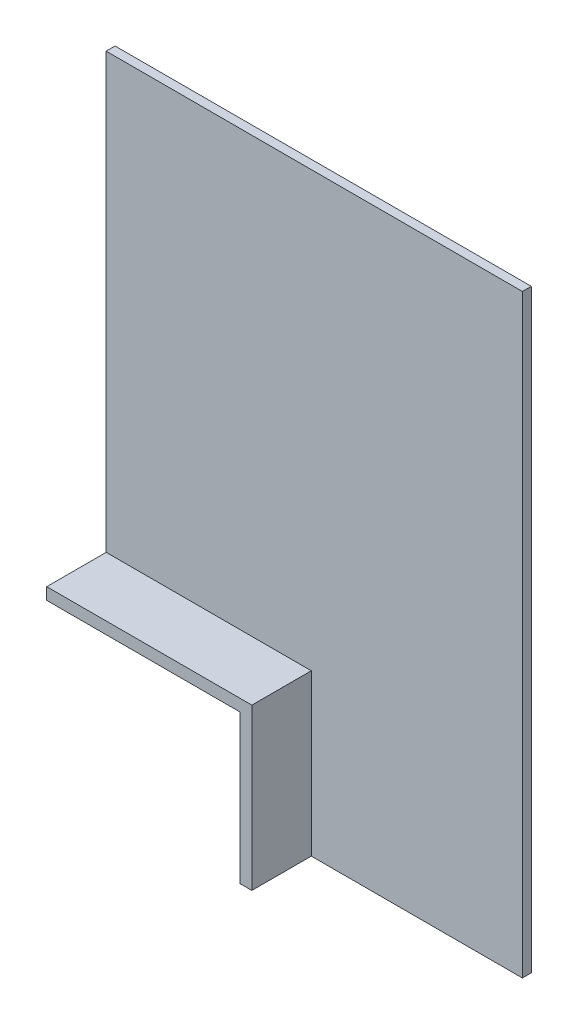
from build123d import *

# Parameters (mm, degrees)
SKETCH_1_W          = 140
SKETCH_1_H          = 200
EXTRUDE_1_DEPTH     = 3
SKETCH_2_W          = 65
SKETCH_2_H          = 50
CUT_EXTRUDE_1_DEPTH = 10
SKETCH_3_W          = 4
SKETCH_3_H          = 50
EXTRUDE_2_DEPTH     = 23


with BuildPart() as part:
    # 草图1 → 凸台-拉伸1 (new body)
    with BuildSketch(Plane.XY):
        with Locations((70, -100)):
            Rectangle(SKETCH_1_W, SKETCH_1_H)
    extrude(amount=EXTRUDE_1_DEPTH)

    # 草图2 → 切除-拉伸1 (cut)
    with BuildSketch(Plane(origin=(0, 0, 0), x_dir=(-1, 0, 0), z_dir=(0, 0, -1))):
        with Locations((-32.5, -175)):
            Rectangle(SKETCH_2_W, SKETCH_2_H)
    extrude(amount=-CUT_EXTRUDE_1_DEPTH, mode=Mode.SUBTRACT)

    # 草图3 → 凸台-拉伸2 (add)
    with BuildSketch(Plane(origin=(0, 0, 0), x_dir=(-1, 0, 0), z_dir=(0, 0, -1))):
        with Locations((-67, -175)):
            Rectangle(SKETCH_3_W, SKETCH_3_H)
        Polygon((-65, -150), (0, -150), (0, -146), (-69, -146), (-69, -150), align=None)
    extrude(amount=-EXTRUDE_2_DEPTH)


solid = part.part
